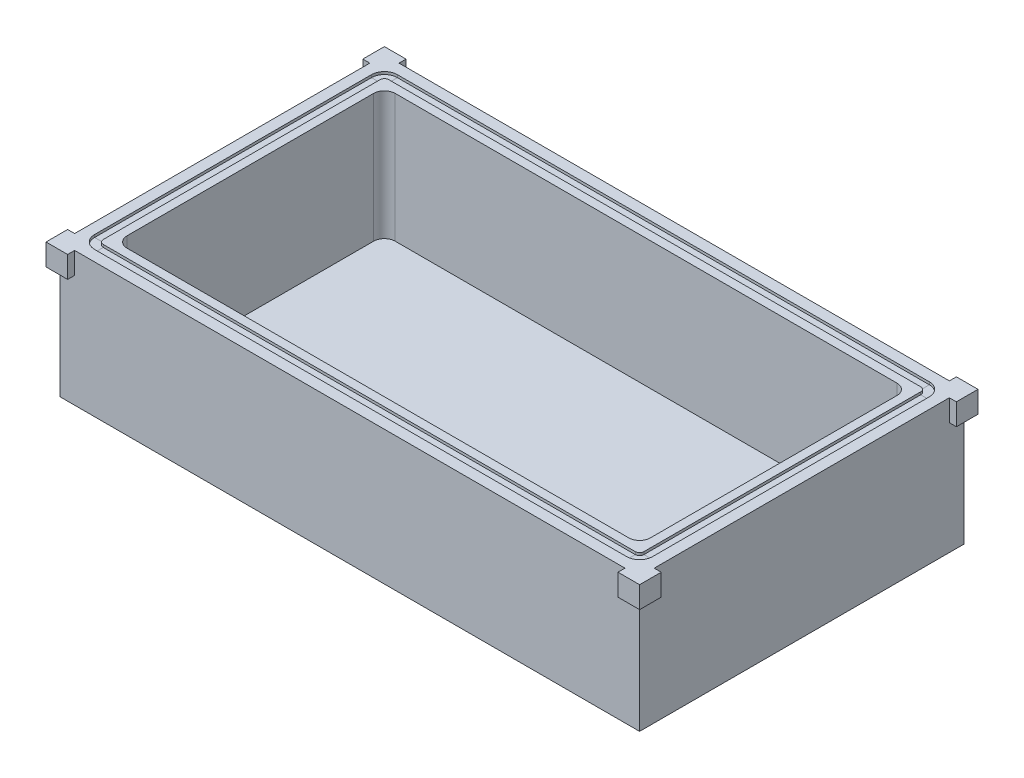
from build123d import *

# Parameters (mm, degrees)
SKETCH1_W           = 170.18
SKETCH1_H           = 95.25
BOSS_EXTRUDE1_DEPTH = 39.37
SKETCH2_W           = 153.67
SKETCH2_H           = 78.74
CUT_EXTRUDE1_DEPTH  = 37.592
SKETCH4_W           = 2.54
SKETCH4_H           = 1.524
FILLET1_R           = 3.175
SKETCH5_W           = 6.35
SKETCH5_H           = 6.35
BOSS_EXTRUDE2_DEPTH = 6.35


with BuildPart() as part:
    # Sketch1 → Boss-Extrude1 (new body)
    with BuildSketch(Plane(origin=(0, 0, 0), x_dir=(1, 0, 0), z_dir=(0, 1, 0))):
        Rectangle(SKETCH1_W, SKETCH1_H)
    extrude(amount=BOSS_EXTRUDE1_DEPTH)

    # Sketch2 → Cut-Extrude1 (cut)
    with BuildSketch(Plane(origin=(0, 39.37, 0), x_dir=(1, 0, 0), z_dir=(0, 1, 0))):
        Rectangle(SKETCH2_W, SKETCH2_H)
    extrude(amount=-CUT_EXTRUDE1_DEPTH, mode=Mode.SUBTRACT)

    # Cut-Sweep1: sweep along a path in Sketch3
    with BuildLine(Plane(origin=(0, 39.37, 0), x_dir=(1, 0, 0), z_dir=(0, 1, 0))) as cut_sweep1_path:
        Line((-78.105, -43.18), (78.105, -43.18))
        ThreePointArc((78.105, -43.18), (79.901051224, -42.436051224), (80.645, -40.64))
        Line((80.645, -40.64), (80.645, 40.64))
        ThreePointArc((80.645, 40.64), (79.901051224, 42.436051224), (78.105, 43.18))
        Line((78.105, 43.18), (-78.105, 43.18))
        ThreePointArc((-78.105, 43.18), (-79.901051224, 42.436051224), (-80.645, 40.64))
        Line((-80.645, 40.64), (-80.645, -40.64))
        ThreePointArc((-80.645, -40.64), (-79.901051224, -42.436051224), (-78.105, -43.18))
    # Sketch4 → Cut-Sweep1 (sweep, cut)
    with BuildSketch(Plane(origin=(-80.645, 39.37, 40.64), x_dir=(1, 0, 0), z_dir=(0, 0, 1))):
        Rectangle(SKETCH4_W, SKETCH4_H)
    sweep(path=cut_sweep1_path.line, mode=Mode.SUBTRACT)

    # Fillet1
    fillet1_edges = [part.edges().sort_by_distance(p)[0] for p in [
        (76.835, 20.574, 39.37),
        (-76.835, 20.574, 39.37),
        (-76.835, 20.574, -39.37),
        (76.835, 20.574, -39.37),
    ]]
    fillet(fillet1_edges, radius=FILLET1_R)

    # Sketch5 → Boss-Extrude2 (add)
    with BuildSketch(Plane(origin=(0, 39.37, 0), x_dir=(1, 0, 0), z_dir=(0, 1, 0))):
        with Locations((-83.974076836, 46.509076836)):
            Rectangle(SKETCH5_W, SKETCH5_H)
        with Locations((83.974076836, 46.509076836)):
            Rectangle(SKETCH5_W, SKETCH5_H)
        with Locations((83.974076836, -46.509076836)):
            Rectangle(SKETCH5_W, SKETCH5_H)
        with Locations((-83.974076836, -46.509076836)):
            Rectangle(SKETCH5_W, SKETCH5_H)
    extrude(amount=-BOSS_EXTRUDE2_DEPTH)


solid = part.part
